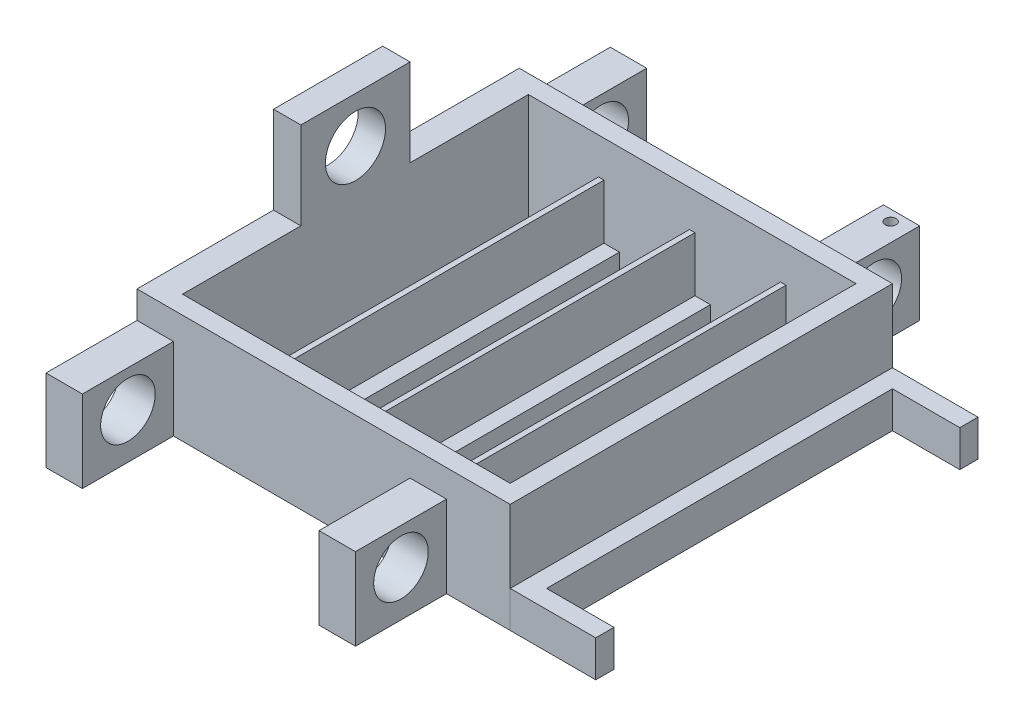
from build123d import *

# Parameters (mm, degrees)
EXTRUDE_2_DEPTH        = 105
EXTRUDE_4_DEPTH        = 30
SHELL_1_T              = -10
SKETCH_9_W             = 50
SKETCH_9_H             = 45
SKETCH_9_R             = 15
EXTRUDE_6_DEPTH        = 20
PATTERN_LINEAR_2_COUNT = 2
PATTERN_LINEAR_2_PITCH = 150
SKETCH_12_W            = 60
SKETCH_12_H            = 58
SKETCH_12_R            = 16.5
EXTRUDE_9_DEPTH        = 10
SKETCH_14_R            = 16.5
EXTRUDE_11_DEPTH       = 5
SKETCH_8_W             = 20
SKETCH_8_H             = 190
EXTRUDE_5_DEPTH        = 20
SKETCH_15_W            = 252
SKETCH_15_H            = 10
CUT_EXTRUDE_12_DEPTH   = 219
SKETCH_16_W            = 3
SKETCH_16_H            = 190
SKETCH_16_H_2          = 185.234967969
EXTRUDE_13_DEPTH       = 30
EXTRUDE_14_DEPTH       = 10
SKETCH_19_R            = 3
CUT_EXTRUDE_16_DEPTH   = 10


with BuildPart() as part:
    # 草图5 → 拉伸2 (new, symmetric)
    with BuildSketch(Plane.XY):
        Polygon((0, 0), (-105, 0), (-105, 60), (100, 60), (100, 0), align=None)
    extrude(amount=EXTRUDE_2_DEPTH, both=True)

    # 抽壳1
    shell_1_openings = [part.faces().sort_by_distance(p)[0] for p in [
        (-2.5, 0, 0),
        (-2.5, 60, 0),
    ]]
    offset(amount=SHELL_1_T, openings=shell_1_openings, kind=Kind.INTERSECTION)



with BuildPart() as body_2:
    # 草图7 → 拉伸4 (new body)
    with BuildSketch(Plane(origin=(0, 0, 0), x_dir=(1, 0, 0), z_dir=(0, 1, 0))):
        Polygon((147, 95), (110, 95), (110, -95), (147, -95), (147, -105), (100, -105), (100, 105), (147, 105), align=None)
    extrude(amount=EXTRUDE_4_DEPTH)


with BuildPart() as body_3:
    # 草图9 → 拉伸6 (new body)
    with BuildSketch(Plane.ZY.offset(105)):
        with Locations((130, 32.5)):
            Rectangle(SKETCH_9_W, SKETCH_9_H)
        with Locations((130, 35)):
            Circle(SKETCH_9_R, mode=Mode.SUBTRACT)
    extrude(amount=-EXTRUDE_6_DEPTH)


with BuildPart() as pattern_linear_2_1:
    # 阵列(线性)2: pattern copy
    add(body_3.part.moved(Location(Vector(1, 0, 0) * (1 * PATTERN_LINEAR_2_PITCH))))


with BuildPart() as body_5:
    # 镜向1: mirrored copy
    add(body_3.part.mirror(Plane.XY))


with BuildPart() as body_6:
    # Mirror 1 2: mirrored copy
    add(pattern_linear_2_1.part.mirror(Plane.XY))

    # 草图19 → 拉伸16 (cut)
    with BuildSketch(Plane(origin=(0, 55, 0), x_dir=(1, 0, 0), z_dir=(0, 1, 0))):
        with Locations(Location((55, 149, 0), (0, 0, 270))):
            Circle(SKETCH_19_R)
    extrude(amount=-CUT_EXTRUDE_16_DEPTH, mode=Mode.SUBTRACT)


with BuildPart() as body_7:
    # 草图12 → 拉伸9 (new body)
    with BuildSketch(Plane.ZY.offset(105)):
        with Locations((0, 89)):
            Rectangle(SKETCH_12_W, SKETCH_12_H)
        with Locations((0, 93)):
            Circle(SKETCH_12_R, mode=Mode.SUBTRACT)
    extrude(amount=-EXTRUDE_9_DEPTH)


with BuildPart() as part_1:
    add(part.part)

    add(body_7.part)  # 拉伸11 merges body 7
    # 草图14 → 拉伸11 (add)
    with BuildSketch(Plane(origin=(-95, 0, 0), x_dir=(0, 0, -1), z_dir=(1, 0, 0))):
        Polygon((-30, 60), (-95, 60), (-95, 0), (95, 0), (95, 60), (30, 60), (30, 118), (-30, 118), align=None)
        with Locations(Location((0, 93, 0), (0, 0, 180))):
            Circle(SKETCH_14_R, mode=Mode.SUBTRACT)
    extrude(amount=EXTRUDE_11_DEPTH)

    # 草图8 → 拉伸5 (add)
    with BuildSketch(Plane(origin=(0, 0, 0), x_dir=(1, 0, 0), z_dir=(0, 1, 0))):
        with Locations((50, 0)):
            Rectangle(SKETCH_8_W, SKETCH_8_H)
        Rectangle(SKETCH_8_W, SKETCH_8_H)
        with Locations((-50, 0)):
            Rectangle(SKETCH_8_W, SKETCH_8_H)
    extrude(amount=EXTRUDE_5_DEPTH)


with BuildPart() as cut_extrude_12_tool:
    # 草图15 → 拉伸12 (new body)
    with BuildSketch(Plane.XY.offset(105)):
        with Locations((21, 5)):
            Rectangle(SKETCH_15_W, SKETCH_15_H)
    extrude(amount=-CUT_EXTRUDE_12_DEPTH)


with BuildPart() as part_2:
    add(part_1.part)

    # 拉伸12: cut by cut_extrude_12_tool
    add(cut_extrude_12_tool.part, mode=Mode.SUBTRACT)

    # 草图16 → 拉伸13 (add)
    with BuildSketch(Plane(origin=(0, 20, 0), x_dir=(1, 0, 0), z_dir=(0, 1, 0))):
        with Locations((-50, 0)):
            Rectangle(SKETCH_16_W, SKETCH_16_H)
        Rectangle(SKETCH_16_W, SKETCH_16_H)
        with Locations((50, 2.382516015)):
            Rectangle(SKETCH_16_W, SKETCH_16_H_2)
    extrude(amount=EXTRUDE_13_DEPTH)

    # 草图17 → 拉伸14 (add)
    with BuildSketch(Plane(origin=(0, 60, 0), x_dir=(1, 0, 0), z_dir=(0, 1, 0))):
        Polygon((-105, 30), (-90, 30), (-90, 95), (90, 95), (90, -95), (-90, -95), (-90, -30), (-105, -30), (-105, -105), (100, -105), (100, 105), (-105, 105), align=None)
    extrude(amount=EXTRUDE_14_DEPTH)


with BuildPart() as body_2_1:
    add(body_2.part)

    # 拉伸12: cut by cut_extrude_12_tool
    add(cut_extrude_12_tool.part, mode=Mode.SUBTRACT)


solid = Compound([body_3.part, pattern_linear_2_1.part, body_5.part, body_6.part, part_2.part, body_2_1.part])
